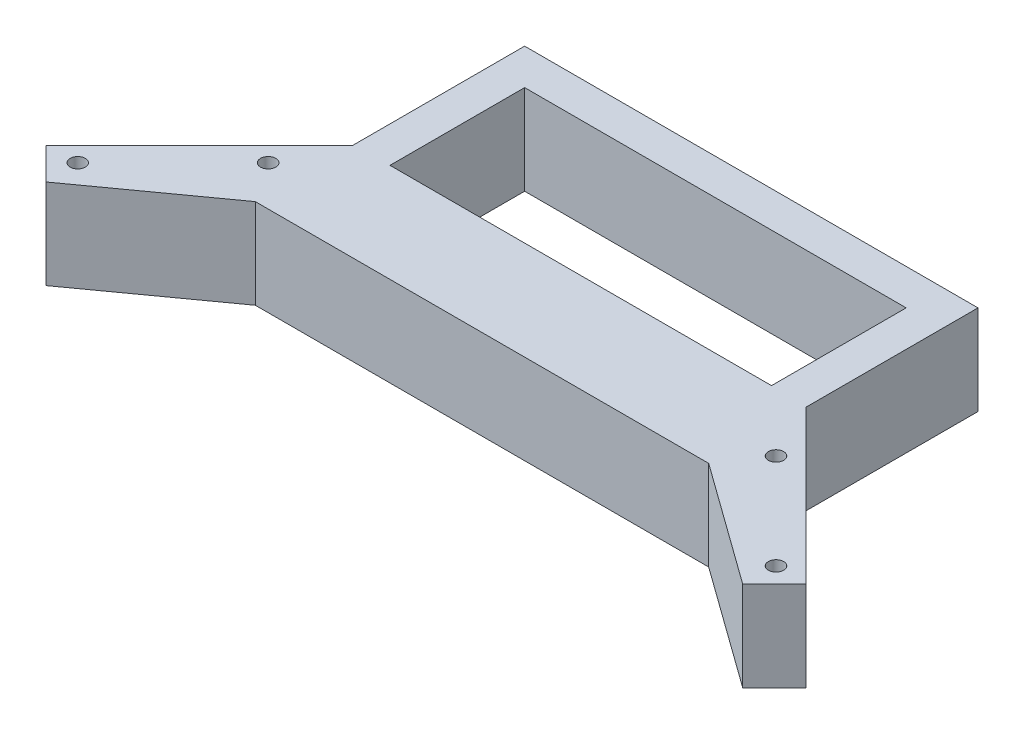
from build123d import *

# Parameters (mm, degrees)
BOSS_EXTRUDE1_DEPTH = 25.4


with BuildPart() as part:
    # Sketch3 → Boss-Extrude1 (new body)
    with BuildSketch(Plane(origin=(0, 0, 0), x_dir=(1, 0, 0), z_dir=(0, 1, 0))):
        Polygon((-53.975, -20.955), (-64.135, -31.115), (-64.135, -50.165), (64.135, -50.165), (64.135, -31.115), (53.975, -20.955), (53.975, -22.225), (-53.975, -22.225), align=None)
        Polygon((-64.135, 26.035), (-64.135, -22.565796173), (-64.135, -31.115), (-53.975, -20.955), (-53.975, 15.875), (-17.145, 15.875), (-6.985, 26.035), align=None)
        Polygon((6.985, 26.035), (-6.985, 26.035), (-17.145, 15.875), (17.145, 15.875), align=None)
        Polygon((64.135, 26.035), (6.985, 26.035), (17.145, 15.875), (53.975, 15.875), (53.975, -20.955), (64.135, -31.115), (64.135, -22.565796173), align=None)
        with BuildLine():
            Line((64.135, -22.565796173), (64.135, -31.115))
            Line((64.135, -31.115), (70.315405428, -37.295405428))
            ThreePointArc((70.315405428, -37.295405428), (72.668262499, -36.827393058), (74.001048969, -38.822048969))
            ThreePointArc((74.001048969, -38.822048969), (73.836704879, -39.648262499), (73.368692509, -40.348692509))
            Line((73.368692509, -40.348692509), (97.256173791, -64.236173791))
            ThreePointArc((97.256173791, -64.236173791), (99.609030862, -63.768161421), (100.941817332, -65.762817332))
            ThreePointArc((100.941817332, -65.762817332), (99.609030862, -67.757473242), (97.256173791, -67.289460872))
            Line((97.256173791, -67.289460872), (93.346419205, -71.199215458))
            Line((93.346419205, -71.199215458), (98.567291185, -74.9585996))
            Line((98.567291185, -74.9585996), (107.547547306, -65.978343479))
            Line((107.547547306, -65.978343479), (64.135, -22.565796173))
        make_face()
        with BuildLine():
            Line((64.135, -31.115), (64.135, -50.165))
            Line((64.135, -50.165), (93.346419205, -71.199215458))
            Line((93.346419205, -71.199215458), (97.256173791, -67.289460872))
            ThreePointArc((97.256173791, -67.289460872), (96.623817332, -65.762817332), (97.256173791, -64.236173791))
            Line((97.256173791, -64.236173791), (73.368692509, -40.348692509))
            ThreePointArc((73.368692509, -40.348692509), (70.315405428, -40.348692509), (70.315405428, -37.295405428))
            Line((70.315405428, -37.295405428), (64.135, -31.115))
        make_face()
        with BuildLine():
            Line((-64.135, -50.165), (-64.135, -31.115))
            Line((-64.135, -31.115), (-70.315405428, -37.295405428))
            ThreePointArc((-70.315405428, -37.295405428), (-69.847393058, -37.995835438), (-69.683048969, -38.822048969))
            ThreePointArc((-69.683048969, -38.822048969), (-71.015835438, -40.816704879), (-73.368692509, -40.348692509))
            Line((-73.368692509, -40.348692509), (-97.256173791, -64.236173791))
            ThreePointArc((-97.256173791, -64.236173791), (-96.788161421, -64.936603801), (-96.623817332, -65.762817332))
            ThreePointArc((-96.623817332, -65.762817332), (-96.788161421, -66.589030862), (-97.256173791, -67.289460872))
            Line((-97.256173791, -67.289460872), (-93.346419205, -71.199215458))
            Line((-93.346419205, -71.199215458), (-64.135, -50.165))
        make_face()
        with BuildLine():
            Line((-64.135, -31.115), (-64.135, -22.565796173))
            Line((-64.135, -22.565796173), (-107.547547306, -65.978343479))
            Line((-107.547547306, -65.978343479), (-98.567291185, -74.9585996))
            Line((-98.567291185, -74.9585996), (-93.346419205, -71.199215458))
            Line((-93.346419205, -71.199215458), (-97.256173791, -67.289460872))
            ThreePointArc((-97.256173791, -67.289460872), (-100.941817332, -65.762817332), (-97.256173791, -64.236173791))
            Line((-97.256173791, -64.236173791), (-73.368692509, -40.348692509))
            ThreePointArc((-73.368692509, -40.348692509), (-73.368692509, -37.295405428), (-70.315405428, -37.295405428))
            Line((-70.315405428, -37.295405428), (-64.135, -31.115))
        make_face()
    extrude(amount=BOSS_EXTRUDE1_DEPTH)


solid = part.part
